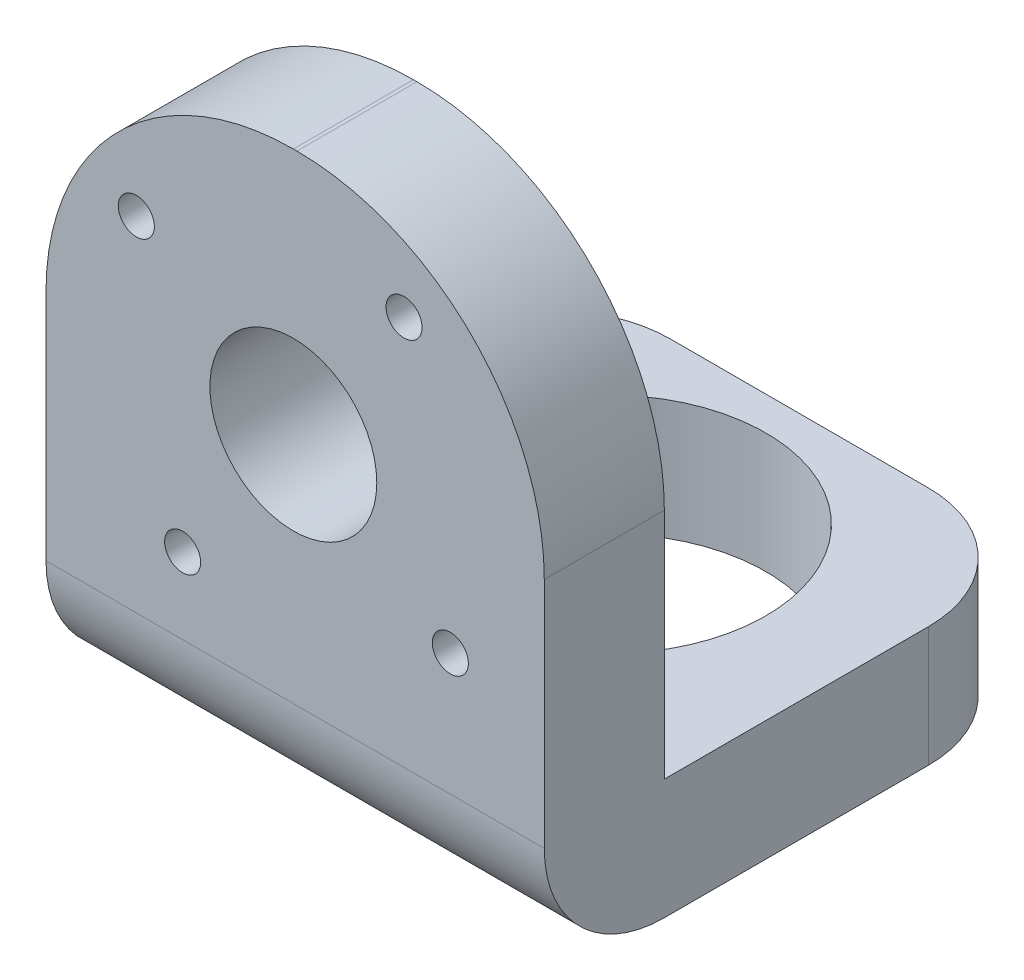
from build123d import *

# Parameters (mm, degrees)
BOSS_EXTRUDE1_DEPTH = 5
BOSS_EXTRUDE2_START = -5
SKETCH2_W           = 20.75
SKETCH2_H           = 5
BOSS_EXTRUDE2_DEPTH = 16
SKETCH3_R           = 6.6
CUT_EXTRUDE1_DEPTH  = 28.634048292
FILLET2_R           = 5
FILLET3_R           = 5
SKETCH5_R           = 3.475
SKETCH5_R_2         = 0.75
CUT_EXTRUDE3_DEPTH  = 27.549776364


with BuildPart() as part:
    # Sketch1 → Boss-Extrude1 (new body)
    with BuildSketch(Plane.XY):
        with BuildLine():
            Line((-0.075, 12.5), (0.075, 12.5))
            ThreePointArc((0.075, 12.5), (7.358199846, 9.483199846), (10.375, 2.2))
            Line((10.375, 2.2), (10.375, -12.5))
            Line((10.375, -12.5), (-10.375, -12.5))
            Line((-10.375, -12.5), (-10.375, 2.2))
            ThreePointArc((-10.375, 2.2), (-7.358199846, 9.483199846), (-0.075, 12.5))
        make_face()
    extrude(amount=BOSS_EXTRUDE1_DEPTH)

    # Sketch2 → Boss-Extrude2 (add)
    with BuildSketch(Plane.XY.offset(5).offset(BOSS_EXTRUDE2_START)):
        with Locations((0, -10)):
            Rectangle(SKETCH2_W, SKETCH2_H)
    extrude(amount=-BOSS_EXTRUDE2_DEPTH)

    # Sketch3 → Cut-Extrude1 (cut, through all)
    with BuildSketch(Plane(origin=(0, -7.5, 0), x_dir=(1, 0, 0), z_dir=(0, 1, 0))):
        with Locations(Location((0, 8, 0), (0, 0, 270))):
            Circle(SKETCH3_R)
    extrude(amount=-CUT_EXTRUDE1_DEPTH, mode=Mode.SUBTRACT)

    # Fillet2
    fillet2_edges = [part.edges().sort_by_distance(p)[0] for p in [
        (10.375, -10, -16),
        (-10.375, -10, -16),
    ]]
    fillet(fillet2_edges, radius=FILLET2_R)

    # Fillet3
    fillet3_edges = [part.edges().sort_by_distance(p)[0] for p in [
        (0, -12.5, 5),
    ]]
    fillet(fillet3_edges, radius=FILLET3_R)

    # Sketch5 → Cut-Extrude3 (cut, through all)
    with BuildSketch(Plane.XY.offset(5)):
        with Locations((-0.075, 2.2)):
            Circle(SKETCH5_R)
        with Locations((-6.613093573, 6.810133667)):
            Circle(SKETCH5_R_2)
        with Locations((4.535133667, 8.738093573)):
            Circle(SKETCH5_R_2)
        with Locations((-4.685133667, -4.338093573)):
            Circle(SKETCH5_R_2)
        with Locations((6.463093573, -2.410133667)):
            Circle(SKETCH5_R_2)
    extrude(amount=-CUT_EXTRUDE3_DEPTH, mode=Mode.SUBTRACT)


solid = part.part
